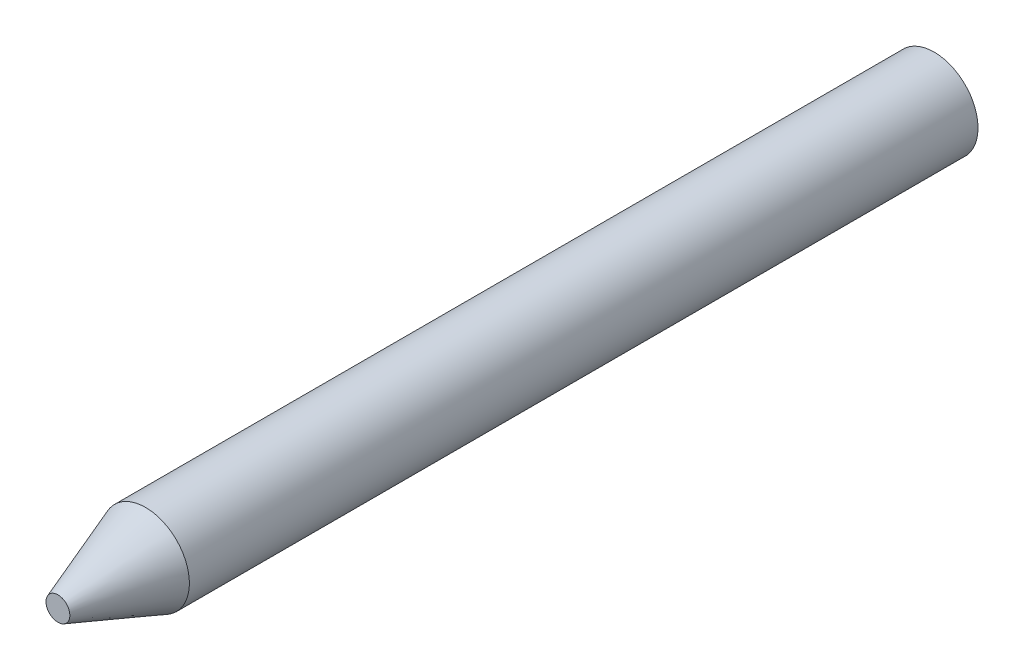
from build123d import *

# Parameters (mm, degrees)
SKETCH_1_R      = 3.5
EXTRUDE_1_DEPTH = 70
CHAMFER_1_SIZE  = 7
CHAMFER_1_SIZE2 = 2.54779164


with BuildPart() as part:
    # Эскиз1 → Бобышка-Вытянуть1 (new body)
    with BuildSketch(Plane.XY):
        Circle(SKETCH_1_R)
    extrude(amount=EXTRUDE_1_DEPTH)

    # Фаска1
    chamfer_1_edges = [part.edges().sort_by_distance(p)[0] for p in [
        (-3.5, 0, 70),
    ]]
    chamfer_1_side = [part.faces().sort_by_distance(p)[0] for p in [
        (-3.5, 0, 35),
    ]]
    chamfer(chamfer_1_edges, length=CHAMFER_1_SIZE, length2=CHAMFER_1_SIZE2, reference=chamfer_1_side[0])


solid = part.part
